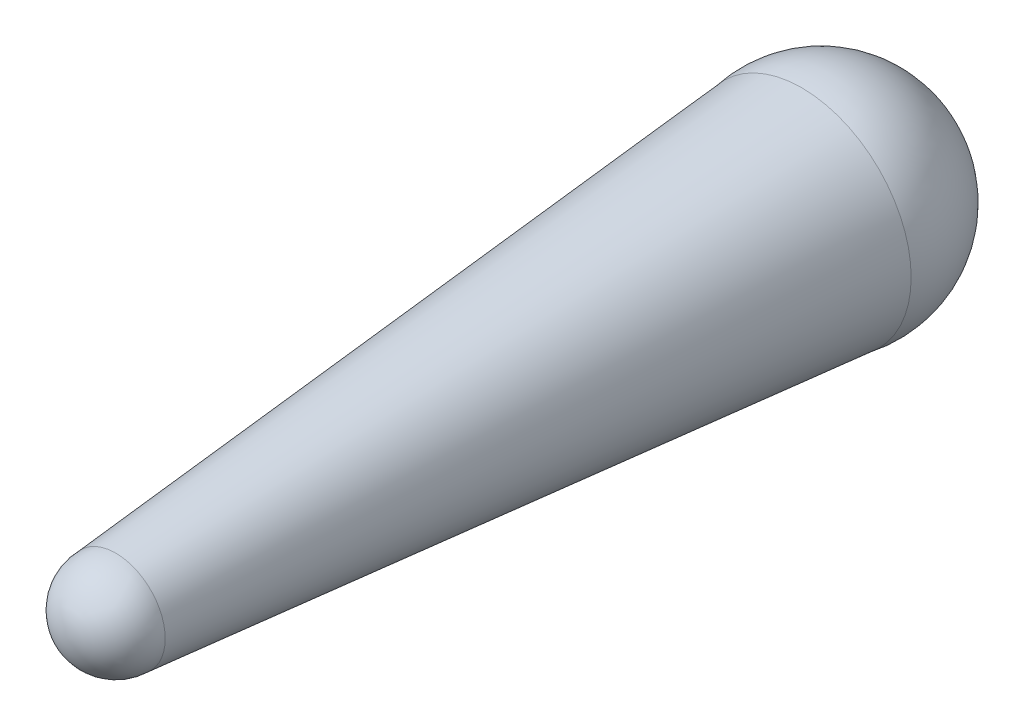
from build123d import *

# Parameters (mm, degrees)
SKETCH2_R           = 1.575
BOSS_EXTRUDE1_DEPTH = 10
BOSS_EXTRUDE1_TAPER = 5


with BuildPart() as part:
    # Sketch1 → Revolve1 (revolve)
    with BuildSketch(Plane.XY):
        with BuildLine():
            Line((0, 1.575), (0, -1.575))
            ThreePointArc((0, -1.575), (1.575, 0), (0, 1.575))
        make_face()
    revolve(axis=Axis((0, 1.575, 0), (0, -1, 0)))

    # Sketch2 → Boss-Extrude1 (add)
    with BuildSketch(Plane.XY):
        Circle(SKETCH2_R)
    extrude(amount=BOSS_EXTRUDE1_DEPTH, taper=BOSS_EXTRUDE1_TAPER)

    # Sketch3 → Revolve2 (revolve)
    with BuildSketch(Plane.XY.offset(10)):
        with BuildLine():
            Line((0, 0.700113365), (0, -0.700113365))
            ThreePointArc((0, -0.700113365), (0.700113365, 0), (0, 0.700113365))
        make_face()
    revolve(axis=Axis((0, 0.700113365, 10), (0, -1, 0)))


solid = part.part
